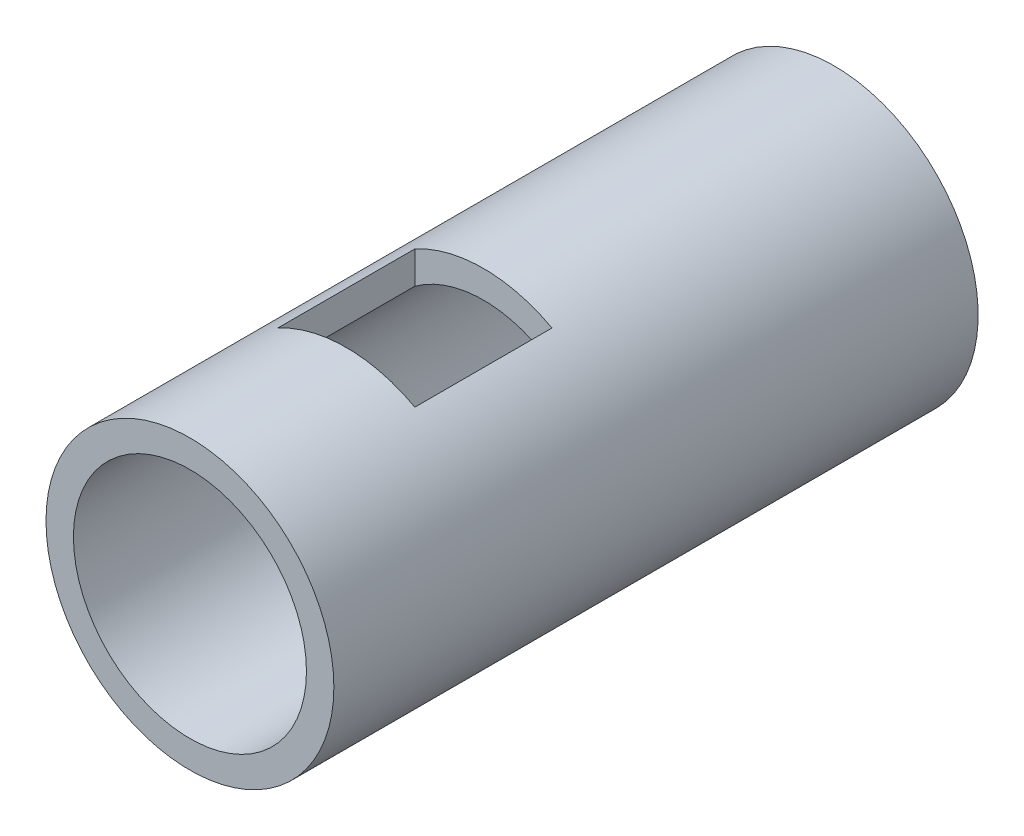
from build123d import *

# Parameters (mm, degrees)
SKETCH1_R           = 10.5
SKETCH1_R_2         = 8.5
BOSS_EXTRUDE1_DEPTH = 45
SKETCH2_W           = 10
SKETCH2_H           = 10
CUT_EXTRUDE1_DEPTH  = 40
BOSS_EXTRUDE4_START = 2
SKETCH6_R           = 10.5
BOSS_EXTRUDE4_DEPTH = 2


with BuildPart() as part:
    # Sketch1 → Boss-Extrude1 (new body)
    with BuildSketch(Plane.XY):
        with Locations(Location((0, 0, 0), (0, 0, 180))):
            Circle(SKETCH1_R)
        with Locations(Location((0, 0, 0), (0, 0, 180))):
            Circle(SKETCH1_R_2, mode=Mode.SUBTRACT)
    extrude(amount=BOSS_EXTRUDE1_DEPTH)

    # Sketch2 → Cut-Extrude1 (cut)
    with BuildSketch(Plane(origin=(0, 0, 0), x_dir=(1, 0, 0), z_dir=(0, 1, 0))):
        with Locations((0, -28.58915915)):
            Rectangle(SKETCH2_W, SKETCH2_H)
    extrude(amount=CUT_EXTRUDE1_DEPTH, mode=Mode.SUBTRACT)

    # Sketch6 → Boss-Extrude4 (add)
    with BuildSketch(Plane(origin=(0, 0, 0), x_dir=(-1, 0, 0), z_dir=(0, 0, -1)).offset(BOSS_EXTRUDE4_START)):
        Circle(SKETCH6_R)
        with BuildLine():
            Line((-8.5, 0), (8.5, 0))
            ThreePointArc((8.5, 0), (0, -8.5), (-8.5, 0))
        make_face(mode=Mode.SUBTRACT)
    extrude(amount=-BOSS_EXTRUDE4_DEPTH)


solid = part.part
